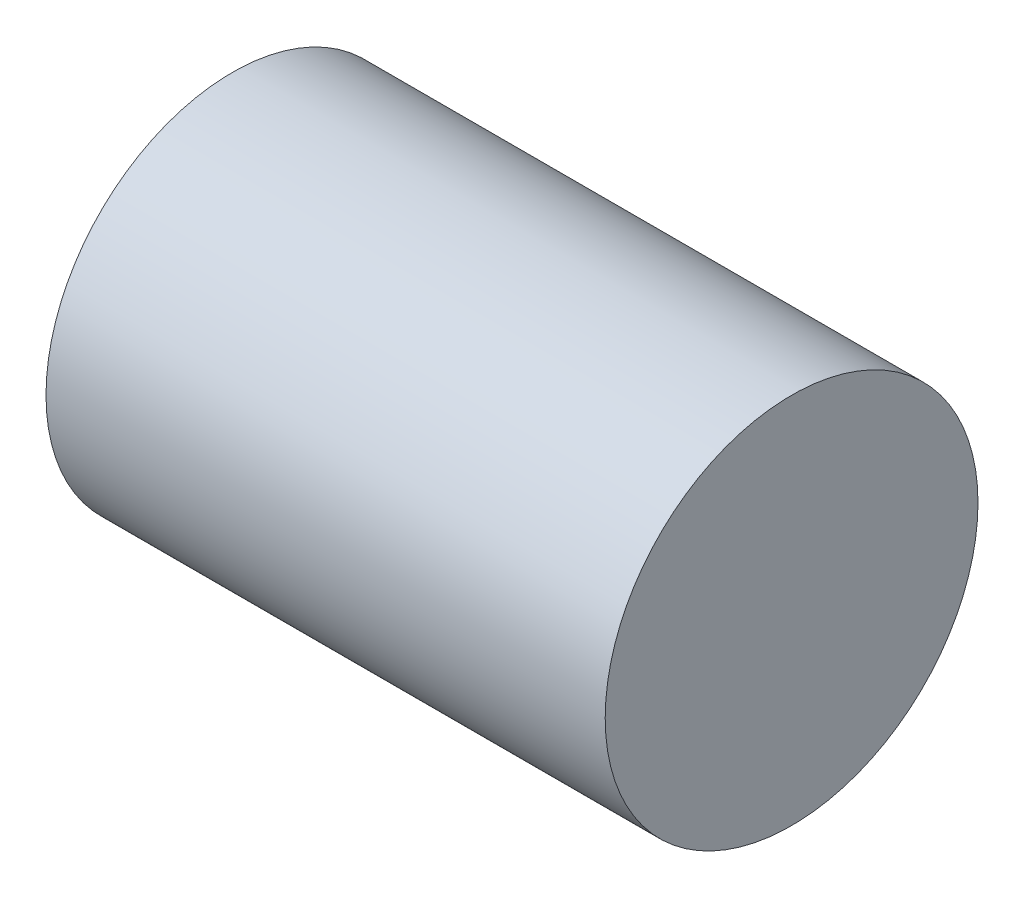
from build123d import *

# Parameters (mm, degrees)
CROQUIS1_R              = 10
SALIENTE_EXTRUIR1_DEPTH = 30


with BuildPart() as part:
    # Croquis1 → Saliente-Extruir1 (new body)
    with BuildSketch(Plane(origin=(0, 0, 0), x_dir=(0, 0, -1), z_dir=(1, 0, 0))):
        Circle(CROQUIS1_R)
    extrude(amount=-SALIENTE_EXTRUIR1_DEPTH)


solid = part.part
